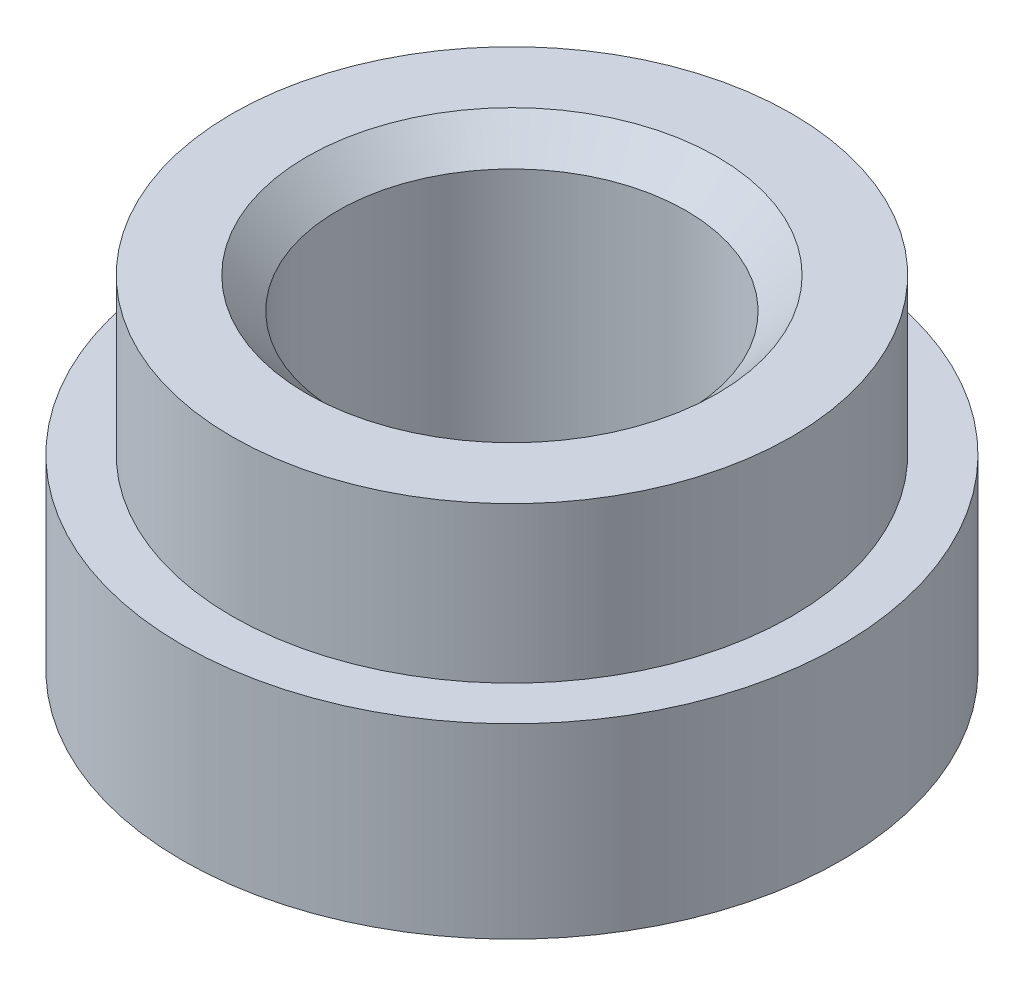
from build123d import *

# Parameters (mm, degrees)
SKETCH1_R           = 2.65
BOSS_EXTRUDE1_DEPTH = 1.5
SKETCH2_R           = 2.25
BOSS_EXTRUDE2_DEPTH = 1.25
SKETCH3_R           = 1.4
CUT_EXTRUDE1_DEPTH  = 5.648386817
CHAMFER1_SIZE       = 0.25


with BuildPart() as part:
    # Sketch1 → Boss-Extrude1 (new body)
    with BuildSketch(Plane(origin=(0, 0, 0), x_dir=(1, 0, 0), z_dir=(0, 1, 0))):
        with Locations(Location((0, 0, 0), (0, 0, 270))):
            Circle(SKETCH1_R)
    extrude(amount=BOSS_EXTRUDE1_DEPTH)

    # Sketch2 → Boss-Extrude2 (add)
    with BuildSketch(Plane(origin=(0, 1.5, 0), x_dir=(1, 0, 0), z_dir=(0, 1, 0))):
        with Locations(Location((0, 0, 0), (0, 0, 270))):
            Circle(SKETCH2_R)
    extrude(amount=BOSS_EXTRUDE2_DEPTH)

    # Sketch3 → Cut-Extrude1 (cut, through all)
    with BuildSketch(Plane(origin=(0, 2.75, 0), x_dir=(1, 0, 0), z_dir=(0, 1, 0))):
        with Locations(Location((0, 0, 0), (0, 0, 270))):
            Circle(SKETCH3_R)
    extrude(amount=-CUT_EXTRUDE1_DEPTH, mode=Mode.SUBTRACT)

    # Chamfer1
    chamfer1_edges = [part.edges().sort_by_distance(p)[0] for p in [
        (0, 0, -1.4),
        (0, 2.75, -1.4),
    ]]
    chamfer(chamfer1_edges, length=CHAMFER1_SIZE)


solid = part.part
